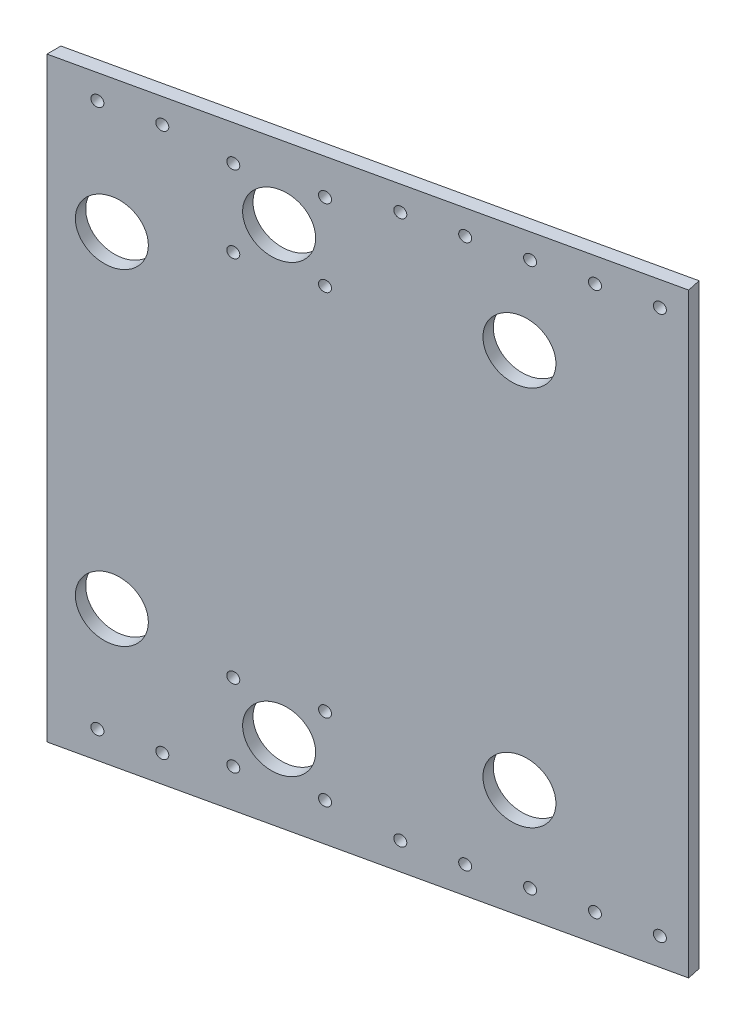
from build123d import *

# Parameters (mm, degrees)
SKETCH1_W                      = 278.13
SKETCH1_H                      = 251.191235252
BOSS_EXTRUDE1_DEPTH            = 6.35
DRAFT1_ANGLE                   = -12.5
HOLE1_D                        = 28.575
HOLE1_DEPTH                    = 59.131528827
F_7_0_201_DIAMETER_HOLE1_D     = 5.1054
F_7_0_201_DIAMETER_HOLE1_DEPTH = 59.131528827


with BuildPart() as part:
    # Sketch1 → Boss-Extrude1 (new body)
    with BuildSketch(Plane(origin=(158.268774626, 0, 713.904307571), x_dir=(0, 1, 0), z_dir=(0.2164396139381031, 0, 0.9762960071199334))):
        with Locations((145.415, -448.825686245)):
            Rectangle(SKETCH1_W, SKETCH1_H)
    extrude(amount=-BOSS_EXTRUDE1_DEPTH)

    # Draft1
    draft1_faces = [part.faces().sort_by_distance(p)[0] for p in [
        (473.149804226, 145.415, 640.844776483),
    ]]
    draft(draft1_faces, Plane(origin=(158.268774626, 0, 713.904307571), x_dir=(0.9762960071199334, 0, -0.2164396139381031), z_dir=(0.21643961393810307, 0, 0.9762960071199333)), DRAFT1_ANGLE)

    # Hole1
    with Locations(Plane(origin=(158.268774626, 0, 713.904307571), x_dir=(0.9762960071199339, 0, -0.21643961393810046), z_dir=(0.21643961393810046, 0, 0.9762960071199339))):
        with Locations((348.630068619, 69.85), (508.166081715, 57.15), (508.166081715, 234.95), (348.630068619, 222.25), (414.112652808, 42.099584365), (414.112652808, 250.000415635)):
            Hole(HOLE1_D / 2, depth=HOLE1_DEPTH)

    # #7 (0.201) Diameter Hole1
    with Locations(Plane(origin=(158.268774626, 0, 713.904307571), x_dir=(0.9762960071199334, 0, -0.21643961393810307), z_dir=(0.21643961393810304, 0, 0.9762960071199333))):
        with Locations((461.529064979, 273.05), (512.329064979, 273.05), (563.129064979, 273.05), (537.729064979, 273.05), (486.929064979, 273.05), (368.368874158, 273.05), (461.529064979, 19.05), (486.929064979, 19.05), (512.329064979, 19.05), (537.729064979, 19.05), (563.129064979, 19.05), (368.368874158, 19.05), (342.968874158, 19.05), (432.07316505, 24.139072123), (432.07316505, 60.060096607), (396.152140566, 24.139072123), (396.152140566, 60.060096607), (432.07316505, 267.960927877), (396.152140566, 267.960927877), (432.07316505, 232.039903393), (396.152140566, 232.039903393), (342.968874158, 273.05)):
            Hole(F_7_0_201_DIAMETER_HOLE1_D / 2, depth=F_7_0_201_DIAMETER_HOLE1_DEPTH)


solid = part.part
